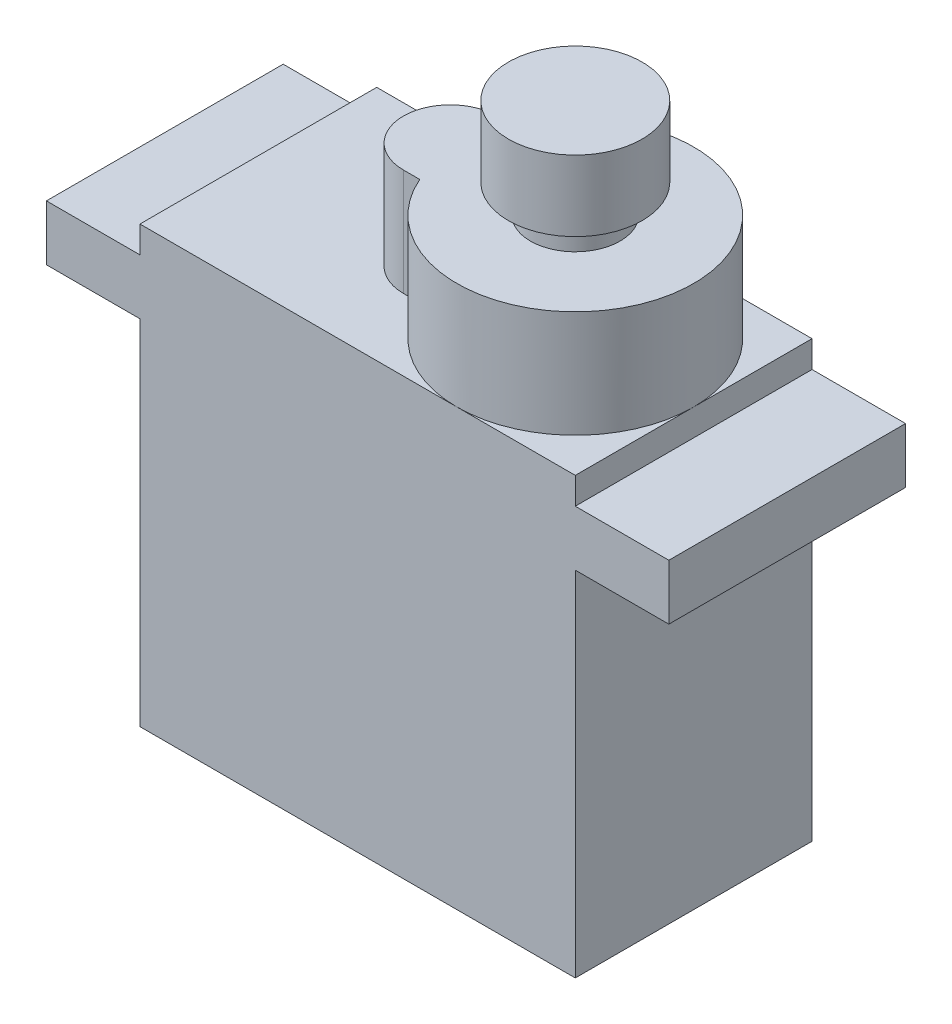
from build123d import *

# Parameters (mm, degrees)
BOSS_EXTRU_1_DEPTH = 12.4
BOSS_EXTRU_2_DEPTH = 5.6
ESQUISSE3_R        = 2.35
BOSS_EXTRU_3_DEPTH = 5.2
ESQUISSE4_R        = 3.5
BOSS_EXTRU_4_DEPTH = 3.7


with BuildPart() as part:
    # Esquisse1 → Boss.-Extru.1 (new body)
    with BuildSketch(Plane.XY):
        Polygon((-11.4, 10), (-16.3, 10), (-16.3, 7.1), (-11.4, 7.1), (-11.4, -11.4), (11.4, -11.4), (11.4, 7.1), (16.3, 7.1), (16.3, 10), (11.4, 10), (11.4, 11.4), (-11.4, 11.4), align=None)
    extrude(amount=BOSS_EXTRU_1_DEPTH)

    # Esquisse2 → Boss.-Extru.2 (add)
    with BuildSketch(Plane(origin=(0, 11.4, 0), x_dir=(1, 0, 0), z_dir=(0, 1, 0))):
        with BuildLine():
            Line((-1.35, -3.75), (-0.495392875, -3.75))
            ThreePointArc((-0.495392875, -3.75), (11.4, -6.2), (-0.495392875, -8.65))
            Line((-0.495392875, -8.65), (-1.35, -8.65))
            ThreePointArc((-1.35, -8.65), (-3.8, -6.2), (-1.35, -3.75))
        make_face()
    extrude(amount=BOSS_EXTRU_2_DEPTH)

    # Esquisse3 → Boss.-Extru.3 (add)
    with BuildSketch(Plane(origin=(0, 17, 0), x_dir=(1, 0, 0), z_dir=(0, 1, 0))):
        with Locations(Location((5.2, -6.2, 0), (0, 0, 270))):
            Circle(ESQUISSE3_R)
    extrude(amount=BOSS_EXTRU_3_DEPTH)

    # Esquisse4 → Boss.-Extru.4 (add)
    with BuildSketch(Plane(origin=(0, 22.2, 0), x_dir=(1, 0, 0), z_dir=(0, 1, 0))):
        with Locations(Location((5.2, -6.2, 0), (0, 0, 270))):
            Circle(ESQUISSE4_R)
    extrude(amount=-BOSS_EXTRU_4_DEPTH)


solid = part.part
